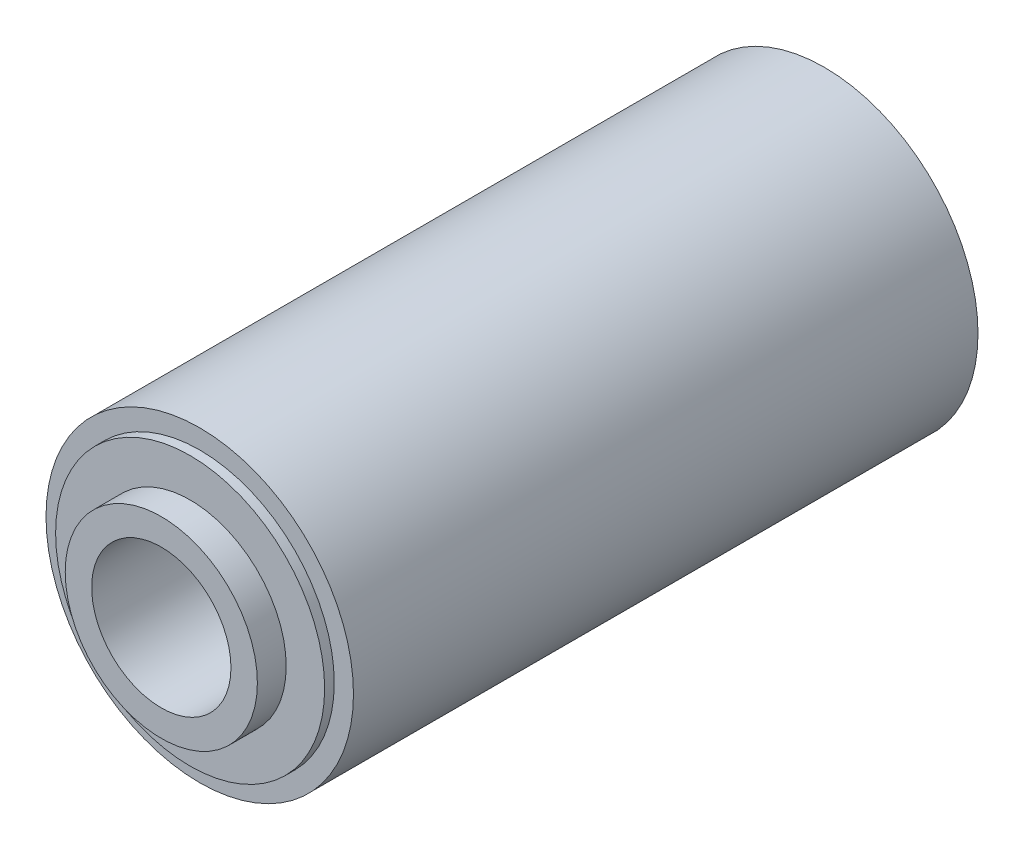
from build123d import *

# Parameters (mm, degrees)
SKETCH_1_R         = 10
SKETCH_1_R_2       = 7.25
EXTRUDE_864_DEPTH  = 73
EXTRUDE_START      = -3
SKETCH_2_R         = 14
SKETCH_2_R_2       = 10
EXTRUDE_986_DEPTH  = 67
EXTRUDE_START_2    = -1
SKETCH_3_R         = 16
SKETCH_3_R_2       = 14
EXTRUDE_1108_DEPTH = 65


with BuildPart() as part:
    # 草图1 → Extrude 864 (new body)
    with BuildSketch(Plane.XY):
        Circle(SKETCH_1_R)
        Circle(SKETCH_1_R_2, mode=Mode.SUBTRACT)
    extrude(amount=EXTRUDE_864_DEPTH)


with BuildPart() as body_2:
    # 草图2 → Extrude 986 (new body)
    with BuildSketch(Plane.XY.offset(73).offset(EXTRUDE_START)):
        Circle(SKETCH_2_R)
        Circle(SKETCH_2_R_2, mode=Mode.SUBTRACT)
    extrude(amount=-EXTRUDE_986_DEPTH)


with BuildPart() as body_3:
    # 草图3 → Extrude 1108 (new body)
    with BuildSketch(Plane.XY.offset(70).offset(EXTRUDE_START_2)):
        Circle(SKETCH_3_R)
        Circle(SKETCH_3_R_2, mode=Mode.SUBTRACT)
    extrude(amount=-EXTRUDE_1108_DEPTH)


solid = Compound([part.part, body_2.part, body_3.part])
